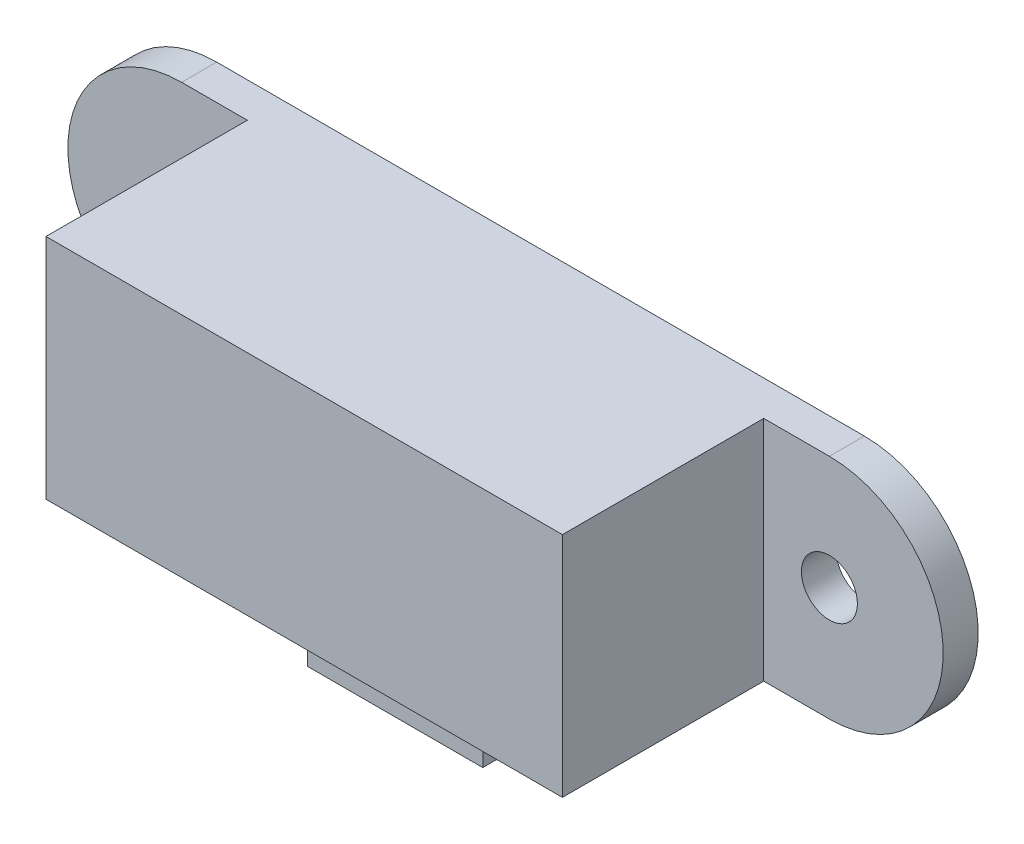
from build123d import *

# Parameters (mm, degrees)
ESQUISSE1_R      = 1.6
EXTRUSION1_DEPTH = 2
ESQUISSE2_W      = 29.5
ESQUISSE2_H      = 13
EXTRUSION2_DEPTH = 11.5
ESQUISSE3_W      = 10
ESQUISSE3_H      = 5
EXTRUSION3_DEPTH = 6


with BuildPart() as part:
    # Esquisse1 → Extrusion1 (new body)
    with BuildSketch(Plane.XY):
        with BuildLine():
            Line((-18.5, -6.5), (18.5, -6.5))
            ThreePointArc((18.5, -6.5), (25, 0), (18.5, 6.5))
            Line((18.5, 6.5), (-18.5, 6.5))
            ThreePointArc((-18.5, 6.5), (-25, 0), (-18.5, -6.5))
        make_face()
        with Locations((-18.5, 0)):
            Circle(ESQUISSE1_R, mode=Mode.SUBTRACT)
        with Locations((18.5, 0)):
            Circle(ESQUISSE1_R, mode=Mode.SUBTRACT)
    extrude(amount=EXTRUSION1_DEPTH)

    # Esquisse2 → Extrusion2 (add)
    with BuildSketch(Plane.XY.offset(2)):
        Rectangle(ESQUISSE2_W, ESQUISSE2_H)
    extrude(amount=EXTRUSION2_DEPTH)

    # Esquisse3 → Extrusion3 (add)
    with BuildSketch(Plane.XZ.offset(6.5)):
        with Locations((0, 5.8)):
            Rectangle(ESQUISSE3_W, ESQUISSE3_H)
    extrude(amount=EXTRUSION3_DEPTH)


solid = part.part
